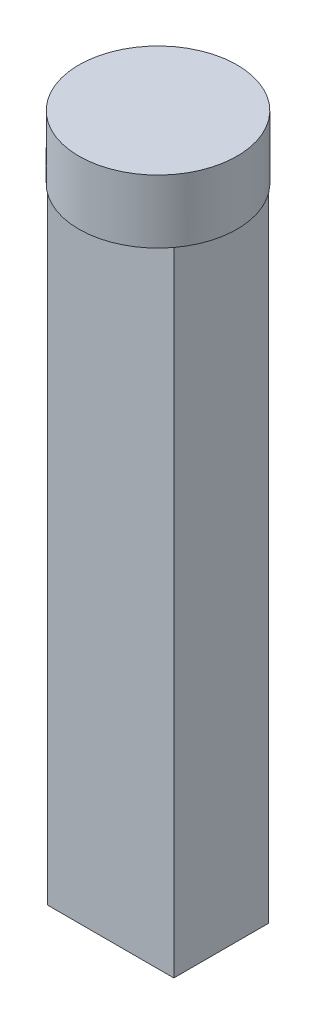
from build123d import *

# Parameters (mm, degrees)
SKETCH1_W           = 20
SKETCH1_H           = 15
BOSS_EXTRUDE1_DEPTH = 100
SKETCH2_R           = 12.5
BOSS_EXTRUDE2_DEPTH = 10


with BuildPart() as part:
    # Sketch1 → Boss-Extrude1 (new body)
    with BuildSketch(Plane(origin=(0, 0, 0), x_dir=(1, 0, 0), z_dir=(0, 1, 0))):
        Rectangle(SKETCH1_W, SKETCH1_H)
    extrude(amount=BOSS_EXTRUDE1_DEPTH)

    # Sketch2 → Boss-Extrude2 (add)
    with BuildSketch(Plane(origin=(0, 100, 0), x_dir=(1, 0, 0), z_dir=(0, 1, 0))):
        with Locations(Location((0, 0, 0), (0, 0, 36.869897646))):
            Circle(SKETCH2_R)
    extrude(amount=BOSS_EXTRUDE2_DEPTH)


solid = part.part
